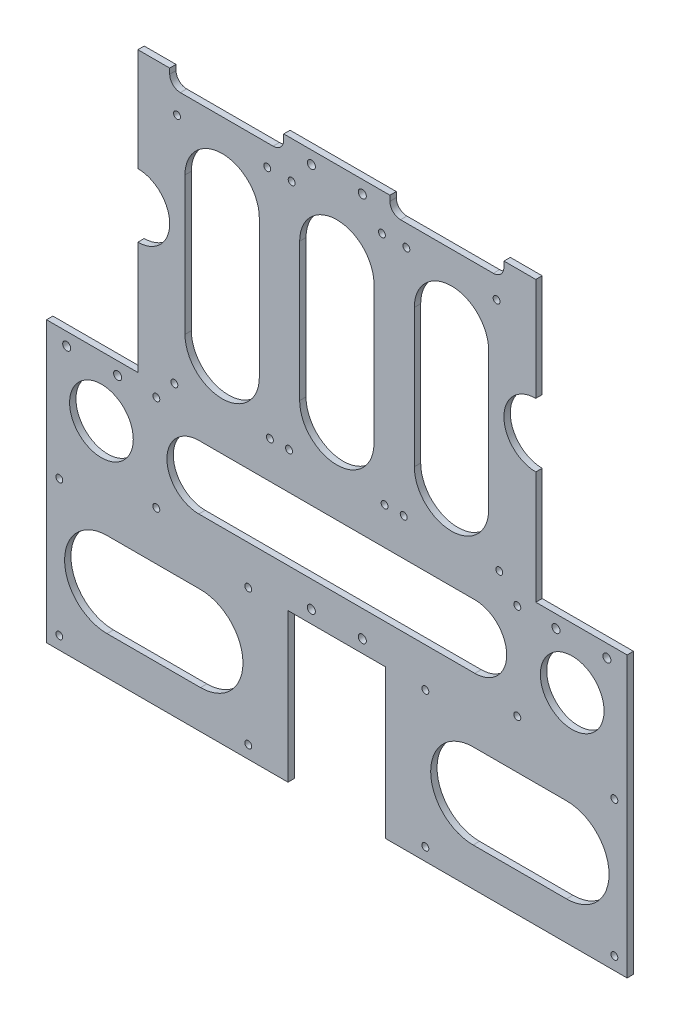
from build123d import *

# Parameters (mm, degrees)
SKETCH1_W             = 273.4
SKETCH1_H             = 263.4
BOSS_EXTRUDE1_DEPTH   = 3
SKETCH2_W             = 43
SKETCH2_H             = 131.64
CUT_EXTRUDE1_DEPTH    = 380.652630703
SKETCH3_W             = 46
SKETCH3_H             = 70
CUT_EXTRUDE2_DEPTH    = 380.652630703
F_4_CLEARANCE_HOLE1_D = 3.2639
CUT_EXTRUDE3_REACH    = 381.653
SKETCH4_R             = 15
F_6_CLEARANCE_HOLE1_D = 3.7973
CUT_EXTRUDE4_REACH    = 381.653


with BuildPart() as part:
    # Sketch1 → Boss-Extrude1 (new body)
    with BuildSketch(Plane.XY):
        with Locations((136.7, -131.7)):
            Rectangle(SKETCH1_W, SKETCH1_H)
    extrude(amount=BOSS_EXTRUDE1_DEPTH)

    # Sketch2 → Cut-Extrude1 (cut, through all)
    with BuildSketch(Plane.XY.offset(3)):
        with Locations((21.5, -65.82)):
            Rectangle(SKETCH2_W, SKETCH2_H)
        with Locations((251.9, -65.82)):
            Rectangle(SKETCH2_W, SKETCH2_H)
    extrude(amount=-CUT_EXTRUDE1_DEPTH, mode=Mode.SUBTRACT)

    # Sketch3 → Cut-Extrude2 (cut, through all)
    with BuildSketch(Plane(origin=(0, 0, 0), x_dir=(-1, 0, 0), z_dir=(0, 0, -1))):
        with Locations((-136.7, -228.4)):
            Rectangle(SKETCH3_W, SKETCH3_H)
    extrude(amount=-CUT_EXTRUDE2_DEPTH, mode=Mode.SUBTRACT)

    # #4 Clearance Hole1 (through all)
    with Locations(Plane(origin=(0, 0, 0), x_dir=(-1, 0, 0), z_dir=(0, 0, -1))):
        with Locations((-267.4, -257.4), (-267.4, -193.4), (-178.4, -193.4), (-178.4, -257.4), (-95, -257.4), (-95, -193.4), (-6, -193.4), (-6, -257.4), (-221.7, -137.5), (-221.7, -182.5), (-51.7, -137.5), (-51.7, -182.5), (-115.45, -17.5), (-157.95, -17.5), (-114.2, -127.5), (-159.2, -127.5), (-61.45, -17.5), (-103.95, -17.5), (-60.2, -127.5), (-105.2, -127.5), (-169.45, -17.5), (-211.95, -17.5), (-168.2, -127.5), (-213.2, -127.5)):
            Hole(F_4_CLEARANCE_HOLE1_D / 2)

    # Sketch4 → Cut-Extrude3 (cut, up to next)
    with BuildSketch(Plane.XY.offset(3), mode=Mode.PRIVATE) as cut_extrude3_sk1:
        with Locations((25.85, -160)):
            Circle(SKETCH4_R)
    cut_extrude3_tool1 = extrude(cut_extrude3_sk1.sketch, amount=-CUT_EXTRUDE3_REACH, mode=Mode.PRIVATE) & part.part
    # Sketch4 → Cut-Extrude3 (cut, up to next)
    with BuildSketch(Plane.XY.offset(3), mode=Mode.PRIVATE) as cut_extrude3_sk2:
        with Locations((247.55, -160)):
            Circle(SKETCH4_R)
    cut_extrude3_tool2 = extrude(cut_extrude3_sk2.sketch, amount=-CUT_EXTRUDE3_REACH, mode=Mode.PRIVATE) & part.part
    # Sketch4 → Cut-Extrude3 (cut, up to next)
    with BuildSketch(Plane.XY.offset(3), mode=Mode.PRIVATE) as cut_extrude3_sk3:
        with BuildLine():
            Line((58, 0), (111.7, 0))
            Line((111.7, 0), (111.7, -2.5))
            ThreePointArc((111.7, -2.5), (110.235533906, -6.035533906), (106.7, -7.5))
            Line((106.7, -7.5), (63, -7.5))
            ThreePointArc((63, -7.5), (59.464466094, -6.035533906), (58, -2.5))
            Line((58, -2.5), (58, 0))
        make_face()
    cut_extrude3_tool3 = extrude(cut_extrude3_sk3.sketch, amount=-CUT_EXTRUDE3_REACH, mode=Mode.PRIVATE) & part.part
    # Sketch4 → Cut-Extrude3 (cut, up to next)
    with BuildSketch(Plane.XY.offset(3), mode=Mode.PRIVATE) as cut_extrude3_sk4:
        with BuildLine():
            Line((43, -48.5), (43, -78.5))
            ThreePointArc((43, -78.5), (58, -63.5), (43, -48.5))
        make_face()
    cut_extrude3_tool4 = extrude(cut_extrude3_sk4.sketch, amount=-CUT_EXTRUDE3_REACH, mode=Mode.PRIVATE) & part.part
    # Sketch4 → Cut-Extrude3 (cut, up to next)
    with BuildSketch(Plane.XY.offset(3), mode=Mode.PRIVATE) as cut_extrude3_sk5:
        with BuildLine():
            Line((230.4, -48.5), (230.4, -78.5))
            ThreePointArc((230.4, -78.5), (215.4, -63.5), (230.4, -48.5))
        make_face()
    cut_extrude3_tool5 = extrude(cut_extrude3_sk5.sketch, amount=-CUT_EXTRUDE3_REACH, mode=Mode.PRIVATE) & part.part
    # Sketch4 → Cut-Extrude3 (cut, up to next)
    with BuildSketch(Plane.XY.offset(3), mode=Mode.PRIVATE) as cut_extrude3_sk6:
        with BuildLine():
            Line((210.4, -7.5), (166.7, -7.5))
            ThreePointArc((166.7, -7.5), (163.164466094, -6.035533906), (161.7, -2.5))
            Line((161.7, -2.5), (161.7, 0))
            Line((161.7, 0), (215.4, 0))
            Line((215.4, 0), (215.4, -2.5))
            ThreePointArc((215.4, -2.5), (213.935533906, -6.035533906), (210.4, -7.5))
        make_face()
    cut_extrude3_tool6 = extrude(cut_extrude3_sk6.sketch, amount=-CUT_EXTRUDE3_REACH, mode=Mode.PRIVATE) & part.part
    add(cut_extrude3_tool1.solids().sort_by_distance((25.85, -160, 3))[0], mode=Mode.SUBTRACT)
    add(cut_extrude3_tool2.solids().sort_by_distance((247.55, -160, 3))[0], mode=Mode.SUBTRACT)
    add(cut_extrude3_tool3.solids().sort_by_distance((84.85, -3.677927, 3))[0], mode=Mode.SUBTRACT)
    add(cut_extrude3_tool4.solids().sort_by_distance((49.366198, -63.5, 3))[0], mode=Mode.SUBTRACT)
    add(cut_extrude3_tool5.solids().sort_by_distance((224.033802, -63.5, 3))[0], mode=Mode.SUBTRACT)
    add(cut_extrude3_tool6.solids().sort_by_distance((188.55, -3.677927, 3))[0], mode=Mode.SUBTRACT)

    # #6 Clearance Hole1 (through all)
    with Locations(Plane.XY.offset(3)):
        with Locations((124.7, -6), (148.7, -6), (9.5, -137.64), (33.5, -137.64), (124.7, -187.4), (148.7, -187.4), (263.9, -137.64), (239.9, -137.64)):
            Hole(F_6_CLEARANCE_HOLE1_D / 2)

    # Sketch9 → Cut-Extrude4 (cut, up to next)
    with BuildSketch(Plane.XY.offset(3), mode=Mode.PRIVATE) as cut_extrude4_sk1:
        with BuildLine():
            Line((72.5, -245.4), (28.5, -245.4))
            ThreePointArc((28.5, -245.4), (8.5, -225.4), (28.5, -205.4))
            Line((28.5, -205.4), (72.5, -205.4))
            ThreePointArc((72.5, -205.4), (92.5, -225.4), (72.5, -245.4))
        make_face()
    cut_extrude4_tool1 = extrude(cut_extrude4_sk1.sketch, amount=-CUT_EXTRUDE4_REACH, mode=Mode.PRIVATE) & part.part
    # Sketch9 → Cut-Extrude4 (cut, up to next)
    with BuildSketch(Plane.XY.offset(3), mode=Mode.PRIVATE) as cut_extrude4_sk2:
        with BuildLine():
            Line((71.7, -145), (201.7, -145))
            ThreePointArc((201.7, -145), (216.7, -160), (201.7, -175))
            Line((201.7, -175), (71.7, -175))
            ThreePointArc((71.7, -175), (56.7, -160), (71.7, -145))
        make_face()
    cut_extrude4_tool2 = extrude(cut_extrude4_sk2.sketch, amount=-CUT_EXTRUDE4_REACH, mode=Mode.PRIVATE) & part.part
    # Sketch9 → Cut-Extrude4 (cut, up to next)
    with BuildSketch(Plane.XY.offset(3), mode=Mode.PRIVATE) as cut_extrude4_sk3:
        with BuildLine():
            Line((154.2, -40), (154.2, -105))
            ThreePointArc((154.2, -105), (136.7, -122.5), (119.2, -105))
            Line((119.2, -105), (119.2, -40))
            ThreePointArc((119.2, -40), (136.7, -22.5), (154.2, -40))
        make_face()
    cut_extrude4_tool3 = extrude(cut_extrude4_sk3.sketch, amount=-CUT_EXTRUDE4_REACH, mode=Mode.PRIVATE) & part.part
    # Sketch9 → Cut-Extrude4 (cut, up to next)
    with BuildSketch(Plane.XY.offset(3), mode=Mode.PRIVATE) as cut_extrude4_sk4:
        with BuildLine():
            Line((208.2, -40), (208.2, -105))
            ThreePointArc((208.2, -105), (190.7, -122.5), (173.2, -105))
            Line((173.2, -105), (173.2, -40))
            ThreePointArc((173.2, -40), (190.7, -22.5), (208.2, -40))
        make_face()
    cut_extrude4_tool4 = extrude(cut_extrude4_sk4.sketch, amount=-CUT_EXTRUDE4_REACH, mode=Mode.PRIVATE) & part.part
    # Sketch9 → Cut-Extrude4 (cut, up to next)
    with BuildSketch(Plane.XY.offset(3), mode=Mode.PRIVATE) as cut_extrude4_sk5:
        with BuildLine():
            Line((100.2, -40), (100.2, -105))
            ThreePointArc((100.2, -105), (82.7, -122.5), (65.2, -105))
            Line((65.2, -105), (65.2, -40))
            ThreePointArc((65.2, -40), (82.7, -22.5), (100.2, -40))
        make_face()
    cut_extrude4_tool5 = extrude(cut_extrude4_sk5.sketch, amount=-CUT_EXTRUDE4_REACH, mode=Mode.PRIVATE) & part.part
    # Sketch9 → Cut-Extrude4 (cut, up to next)
    with BuildSketch(Plane.XY.offset(3), mode=Mode.PRIVATE) as cut_extrude4_sk6:
        with BuildLine():
            Line((200.9, -245.4), (244.9, -245.4))
            ThreePointArc((244.9, -245.4), (264.9, -225.4), (244.9, -205.4))
            Line((244.9, -205.4), (200.9, -205.4))
            ThreePointArc((200.9, -205.4), (180.9, -225.4), (200.9, -245.4))
        make_face()
    cut_extrude4_tool6 = extrude(cut_extrude4_sk6.sketch, amount=-CUT_EXTRUDE4_REACH, mode=Mode.PRIVATE) & part.part
    add(cut_extrude4_tool1.solids().sort_by_distance((50.5, -225.4, 3))[0], mode=Mode.SUBTRACT)
    add(cut_extrude4_tool2.solids().sort_by_distance((136.7, -160, 3))[0], mode=Mode.SUBTRACT)
    add(cut_extrude4_tool3.solids().sort_by_distance((136.7, -72.5, 3))[0], mode=Mode.SUBTRACT)
    add(cut_extrude4_tool4.solids().sort_by_distance((190.7, -72.5, 3))[0], mode=Mode.SUBTRACT)
    add(cut_extrude4_tool5.solids().sort_by_distance((82.7, -72.5, 3))[0], mode=Mode.SUBTRACT)
    add(cut_extrude4_tool6.solids().sort_by_distance((222.9, -225.4, 3))[0], mode=Mode.SUBTRACT)


solid = part.part
